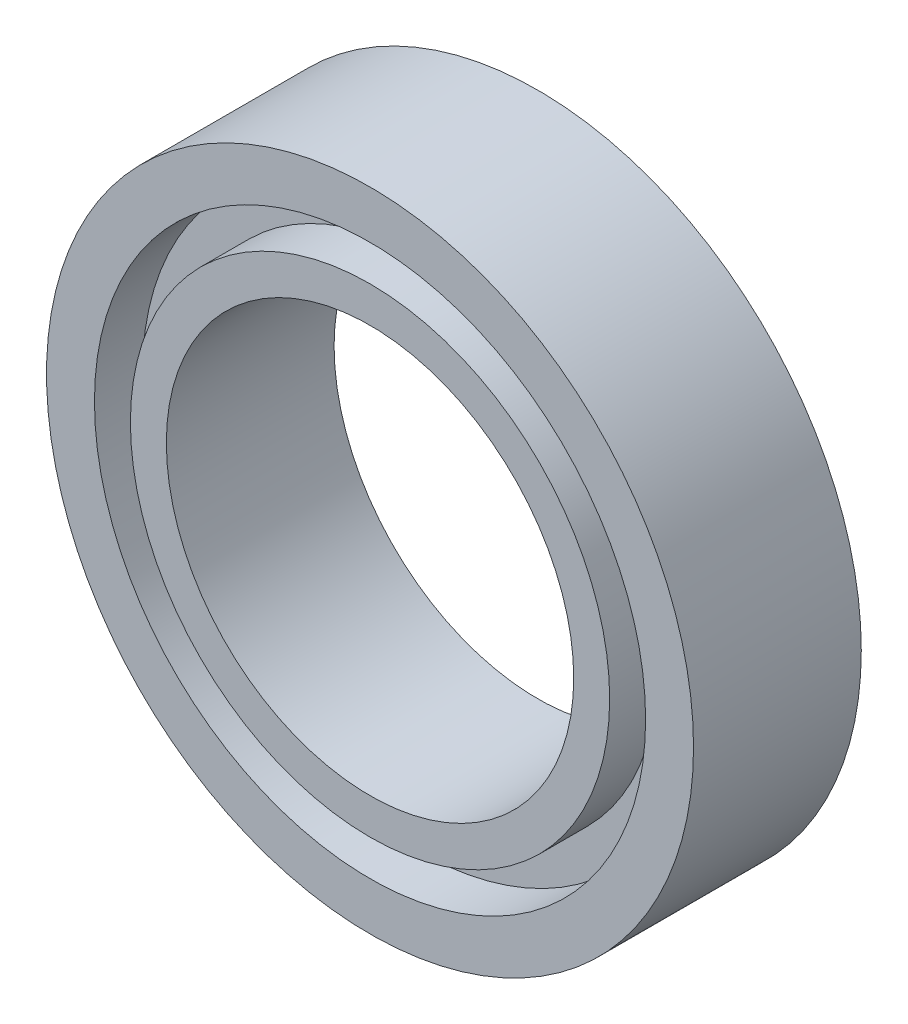
from build123d import *

# Parameters (mm, degrees)
SKETCH1_R           = 13.5
SKETCH1_R_2         = 8.5
BOSS_EXTRUDE1_DEPTH = 7
SKETCH2_R           = 11.5
SKETCH2_R_2         = 10
CUT_EXTRUDE1_DEPTH  = 2


with BuildPart() as part:
    # Sketch1 → Boss-Extrude1 (new body)
    with BuildSketch(Plane.XY):
        Circle(SKETCH1_R)
        Circle(SKETCH1_R_2, mode=Mode.SUBTRACT)
    extrude(amount=BOSS_EXTRUDE1_DEPTH)

    # Sketch2 → Cut-Extrude1 (cut)
    with BuildSketch(Plane.XY.offset(7)):
        Circle(SKETCH2_R)
        Circle(SKETCH2_R_2, mode=Mode.SUBTRACT)
    extrude(amount=-CUT_EXTRUDE1_DEPTH, mode=Mode.SUBTRACT)


solid = part.part
